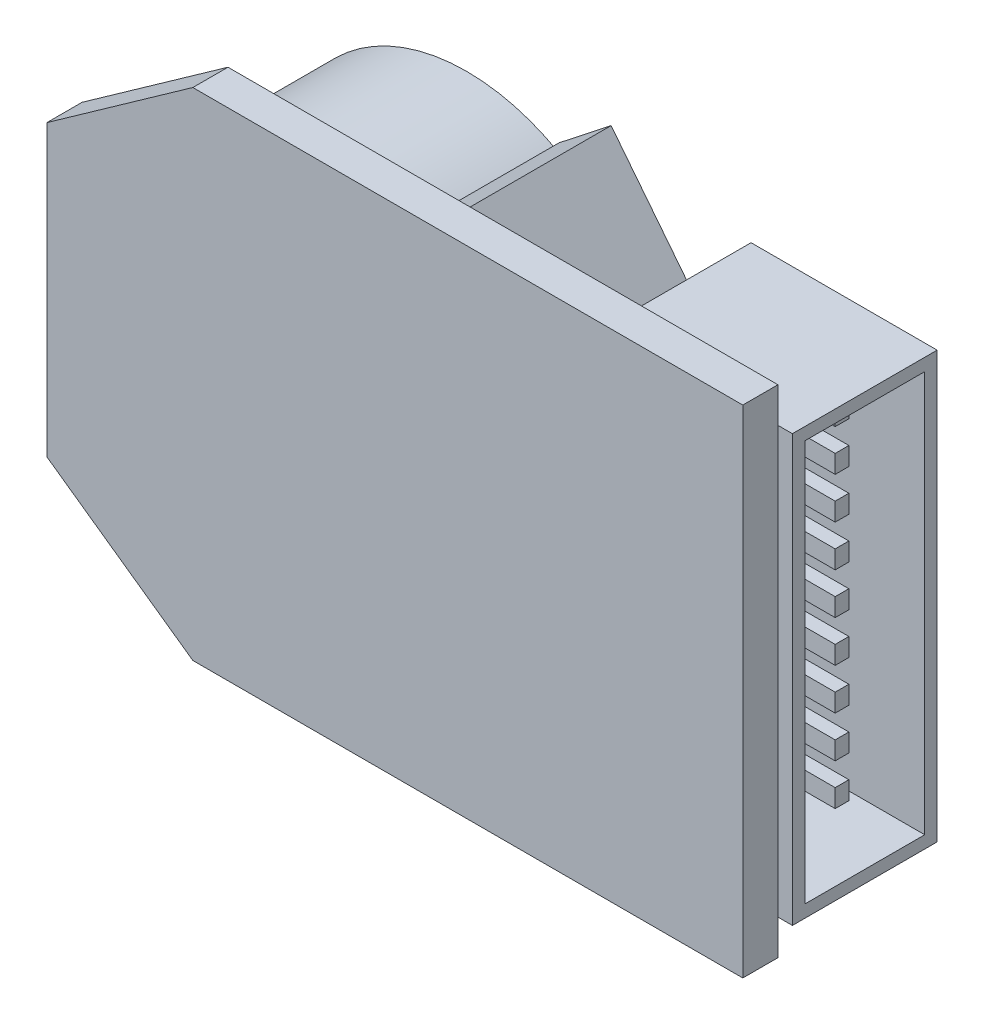
from build123d import *

# Parameters (mm, degrees)
SALIENTE_EXTRUIR1_DEPTH = 0.85
CROQUIS2_R              = 4.5
CROQUIS2_R_2            = 0.732216716
SALIENTE_EXTRUIR2_DEPTH = 3.3
SALIENTE_EXTRUIR3_DEPTH = 3.45
CROQUIS4_W              = 4.5
CROQUIS4_H              = 10.3
SALIENTE_EXTRUIR4_DEPTH = 3.5
CROQUIS5_W              = 2.9
CROQUIS5_H              = 9.7
CORTAR_EXTRUIR1_DEPTH   = 3
CROQUIS6_W              = 0.331262854
CROQUIS6_H              = 0.44
SALIENTE_EXTRUIR6_DEPTH = 2


with BuildPart() as part:
    # Croquis1 → Saliente-Extruir1 (new body)
    with BuildSketch(Plane.XY):
        Polygon((8.415, 6), (-4.885, 6), (-8.415, 3.5), (-8.415, -3.5), (-4.885, -6), (8.415, -6), align=None)
    extrude(amount=SALIENTE_EXTRUIR1_DEPTH)

    # Croquis3 → Saliente-Extruir3 (add)
    with BuildSketch(Plane(origin=(0, 0, 0), x_dir=(-1, 0, 0), z_dir=(0, 0, -1))):
        Polygon((-2.166835619, 4.387836725), (-0.930825273, 5.960184787), (0.327053176, 4.971376511), (-0.908957169, 3.399028449), (-2.144967514, 1.826680388), (-3.402845964, 2.815488664), align=None)
        Polygon((-0.930825273, -5.960184787), (0.327053176, -4.971376511), (-0.908957169, -3.399028449), (-2.144967514, -1.826680388), (-3.402845964, -2.815488664), (-2.166835619, -4.387836725), align=None)
    extrude(amount=SALIENTE_EXTRUIR3_DEPTH)

    # Croquis4 → Saliente-Extruir4 (add)
    with BuildSketch(Plane(origin=(0, 0, 0), x_dir=(-1, 0, 0), z_dir=(0, 0, -1))):
        with Locations((-6.515, 0)):
            Rectangle(CROQUIS4_W, CROQUIS4_H)
    extrude(amount=SALIENTE_EXTRUIR4_DEPTH)

    # Croquis5 → Cortar-Extruir1 (cut)
    with BuildSketch(Plane(origin=(8.765, 0, 0), x_dir=(0, 0, -1), z_dir=(1, 0, 0))):
        with Locations((1.75, 0)):
            Rectangle(CROQUIS5_W, CROQUIS5_H)
    extrude(amount=-CORTAR_EXTRUIR1_DEPTH, mode=Mode.SUBTRACT)

    # Croquis6 → Saliente-Extruir6 (add)
    with BuildSketch(Plane(origin=(5.765, 0, 0), x_dir=(0, 0, -1), z_dir=(1, 0, 0))):
        with Locations((2.2, 0)):
            Rectangle(CROQUIS6_W, CROQUIS6_H)
        with Locations((2.2, 1)):
            Rectangle(CROQUIS6_W, CROQUIS6_H)
        with Locations((2.2, 2)):
            Rectangle(CROQUIS6_W, CROQUIS6_H)
        with Locations((2.2, 3)):
            Rectangle(CROQUIS6_W, CROQUIS6_H)
        with Locations((2.2, 4)):
            Rectangle(CROQUIS6_W, CROQUIS6_H)
        with Locations((2.2, -1)):
            Rectangle(CROQUIS6_W, CROQUIS6_H)
        with Locations((2.2, -2)):
            Rectangle(CROQUIS6_W, CROQUIS6_H)
        with Locations((2.2, -3)):
            Rectangle(CROQUIS6_W, CROQUIS6_H)
        with Locations((2.2, -4)):
            Rectangle(CROQUIS6_W, CROQUIS6_H)
    extrude(amount=SALIENTE_EXTRUIR6_DEPTH)


with BuildPart() as body_2:
    # Croquis2 → Saliente-Extruir2 (new body)
    with BuildSketch(Plane(origin=(0, 0, -1), x_dir=(-1, 0, 0), z_dir=(0, 0, -1))):
        with Locations((3.415, 0)):
            Circle(CROQUIS2_R)
        with Locations((3.415, 0)):
            Circle(CROQUIS2_R_2, mode=Mode.SUBTRACT)
    extrude(amount=SALIENTE_EXTRUIR2_DEPTH)


solid = Compound([part.part, body_2.part])
